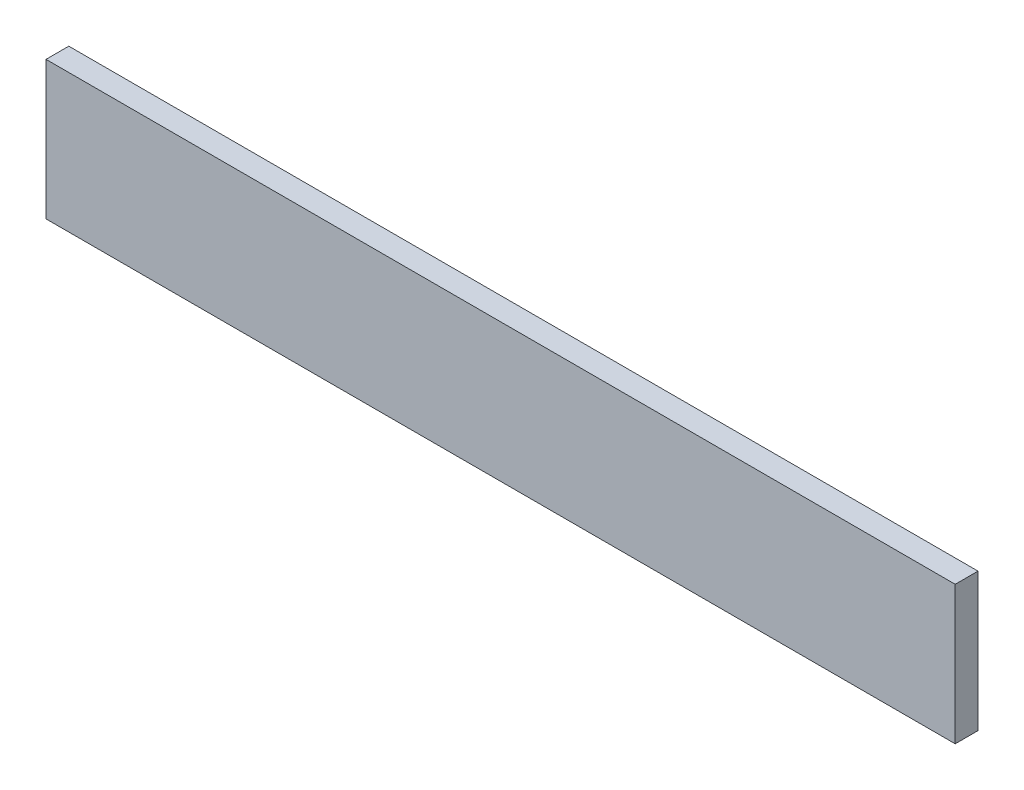
from build123d import *

# Parameters (mm, degrees)
ESBO_O1_W                = 19.8
ESBO_O1_H                = 120
RESSALTO_EXTRUS_O1_DEPTH = 789.6


with BuildPart() as part:
    # Esboço1 → Ressalto-extrusão1 (new body)
    with BuildSketch(Plane(origin=(0, 0, 0), x_dir=(0, 0, -1), z_dir=(1, 0, 0))):
        Rectangle(ESBO_O1_W, ESBO_O1_H)
    extrude(amount=-RESSALTO_EXTRUS_O1_DEPTH)


solid = part.part
